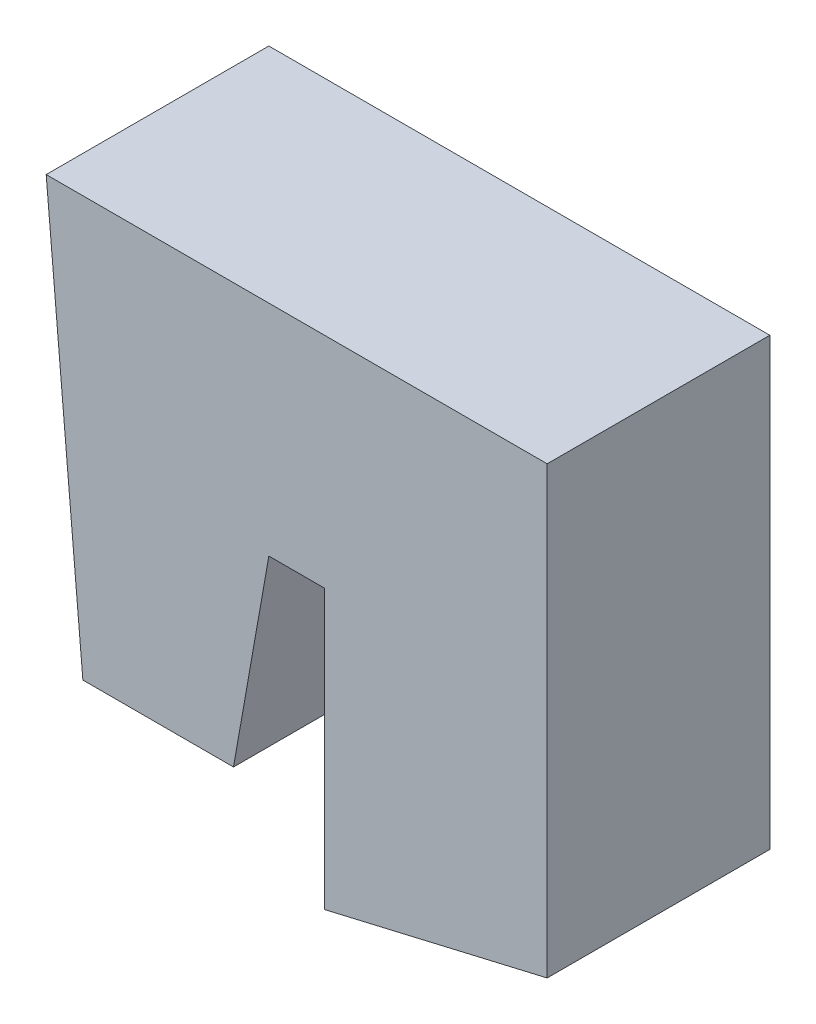
from build123d import *

# Parameters (mm, degrees)
BOSS_EXTRUDE1_DEPTH = 20


with BuildPart() as part:
    # Sketch1 → Boss-Extrude1 (new body)
    with BuildSketch(Plane.XY):
        Polygon((2.5, -22.337662338), (22.5, -17.662337662), (22.5, 22.337662338), (-22.5, 22.337662338), (-19.203836196, -15.337662338), (-5.673885653, -15.337662338), (-2.5, 2.662337662), (2.5, 2.662337662), align=None)
    extrude(amount=-BOSS_EXTRUDE1_DEPTH)


solid = part.part
